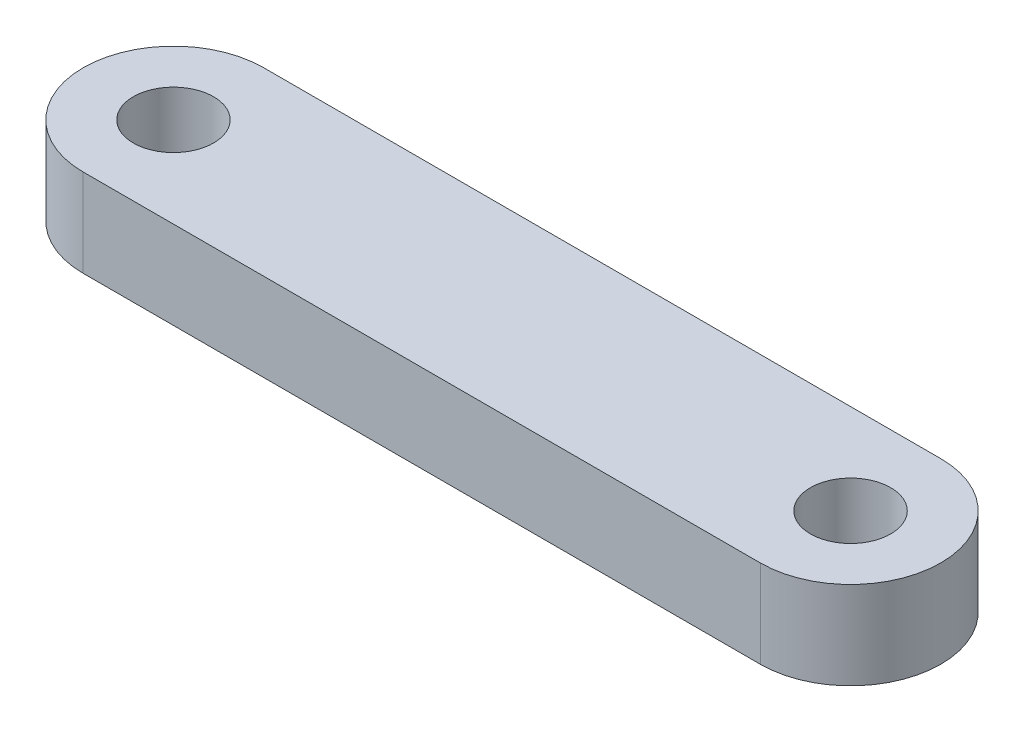
from build123d import *

# Parameters (mm, degrees)
SKETCH1_R           = 1.6
BOSS_EXTRUDE1_DEPTH = 3.5


with BuildPart() as part:
    # Sketch1 → Boss-Extrude1 (new body)
    with BuildSketch(Plane(origin=(0, 0, 0), x_dir=(1, 0, 0), z_dir=(0, 1, 0))):
        with BuildLine():
            Line((-27, 3.6), (0, 3.6))
            ThreePointArc((0, 3.6), (3.6, 0), (0, -3.6))
            Line((0, -3.6), (-27, -3.6))
            ThreePointArc((-27, -3.6), (-30.6, 0), (-27, 3.6))
        make_face()
        with Locations(Location((0, 0, 0), (0, 0, 270))):
            Circle(SKETCH1_R, mode=Mode.SUBTRACT)
        with Locations(Location((-27, 0, 0), (0, 0, 270))):
            Circle(SKETCH1_R, mode=Mode.SUBTRACT)
    extrude(amount=BOSS_EXTRUDE1_DEPTH)


solid = part.part
